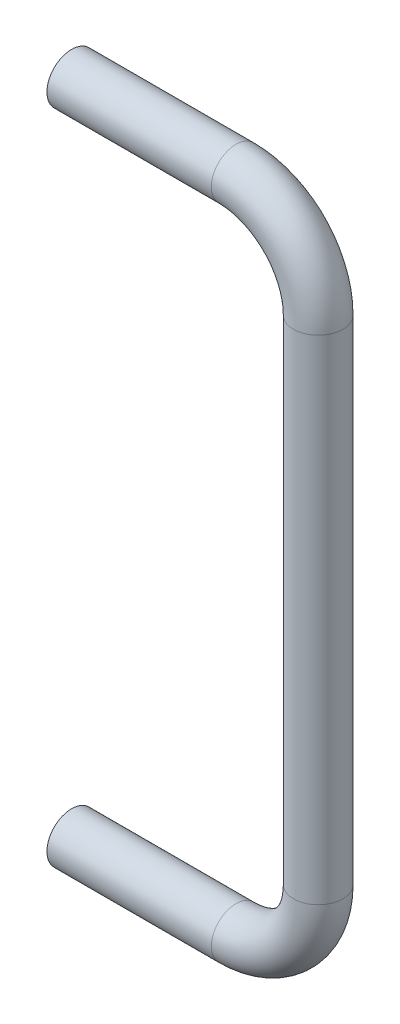
from build123d import *

# Parameters (mm, degrees)
IZIM2_R = 3


with BuildPart() as part:
    # Süpür1: sweep along a path in Çizim1
    with BuildLine(Plane.XY) as s_p_r1_path:
        Line((0, 0), (20, 0))
        ThreePointArc((20, 0), (27.071067812, 2.928932188), (30, 10))
        Line((30, 10), (30, 70))
        ThreePointArc((30, 70), (27.071067812, 77.071067812), (20, 80))
        Line((20, 80), (0, 80))
    # Çizim2 → Süpür1 (sweep)
    with BuildSketch(Plane(origin=(0, 0, 0), x_dir=(0, 0, -1), z_dir=(1, 0, 0))):
        Circle(IZIM2_R)
    sweep(path=s_p_r1_path.line)


solid = part.part
